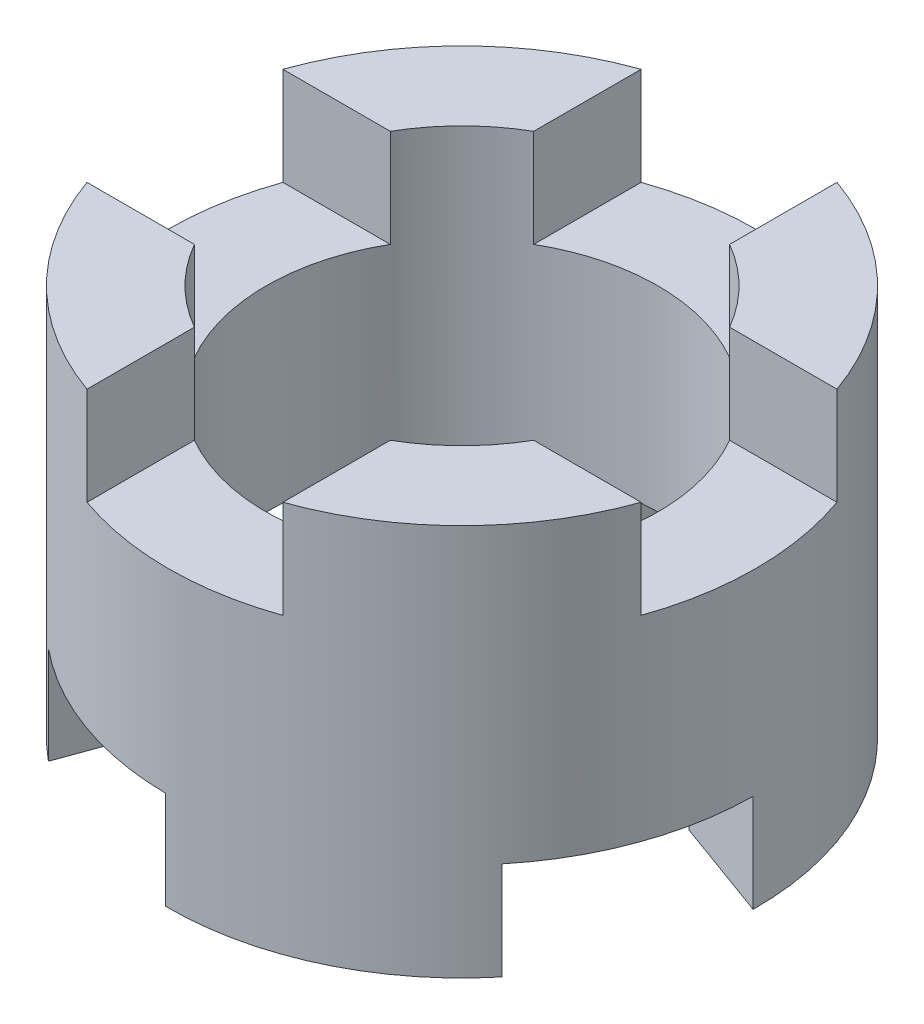
from build123d import *

# Parameters (mm, degrees)
SKETCH2_R           = 19.05
SKETCH2_R_2         = 12.7
BOSS_EXTRUDE2_DEPTH = 25.4
SKETCH4_W           = 149.355111522
SKETCH4_H           = 12.7
CUT_EXTRUDE7_DEPTH  = 6.35
CIRPATTERN1_COUNT   = 2
CIRPATTERN1_ANGLE   = 90
CUT_EXTRUDE9_DEPTH  = 6.35
CIRPATTERN2_COUNT   = 2
CIRPATTERN2_ANGLE   = 90


with BuildPart() as part:
    # Sketch2 → Boss-Extrude2 (new body)
    with BuildSketch(Plane(origin=(0, 0, 0), x_dir=(1, 0, 0), z_dir=(0, 1, 0))):
        with Locations(Location((0, 0, 0), (0, 0, 270))):
            Circle(SKETCH2_R)
        with Locations(Location((0, 0, 0), (0, 0, 270))):
            Circle(SKETCH2_R_2, mode=Mode.SUBTRACT)
    extrude(amount=BOSS_EXTRUDE2_DEPTH)

    # Sketch4 → Cut-Extrude7 (cut)
    with BuildSketch(Plane(origin=(0, 25.4, 0), x_dir=(1, 0, 0), z_dir=(0, 1, 0))):
        Rectangle(SKETCH4_W, SKETCH4_H)
    cut_extrude7 = extrude(amount=-CUT_EXTRUDE7_DEPTH, mode=Mode.SUBTRACT)

    # CirPattern1: Cut-Extrude7 ×2 about axis
    cirpattern1_axis = Axis((0, 25.4, 0), (0, 1, 0))
    for i in range(1, CIRPATTERN1_COUNT):
        add(cut_extrude7.rotate(cirpattern1_axis, i * CIRPATTERN1_ANGLE / (CIRPATTERN1_COUNT - 1)), mode=Mode.SUBTRACT)

    # Sketch8 → Cut-Extrude9 (cut)
    with BuildSketch(Plane.XZ):
        Polygon((-37.904276641, -7.038499593), (33.560620821, 18.972595877), (37.904276641, 7.038499593), (-33.560620821, -18.972595877), align=None)
    cut_extrude9 = extrude(amount=-CUT_EXTRUDE9_DEPTH, mode=Mode.SUBTRACT)

    # CirPattern2: Cut-Extrude9 ×2 about axis
    cirpattern2_axis = Axis((0, 0, 0), (0, 1, 0))
    for i in range(1, CIRPATTERN2_COUNT):
        add(cut_extrude9.rotate(cirpattern2_axis, i * CIRPATTERN2_ANGLE / (CIRPATTERN2_COUNT - 1)), mode=Mode.SUBTRACT)


solid = part.part
